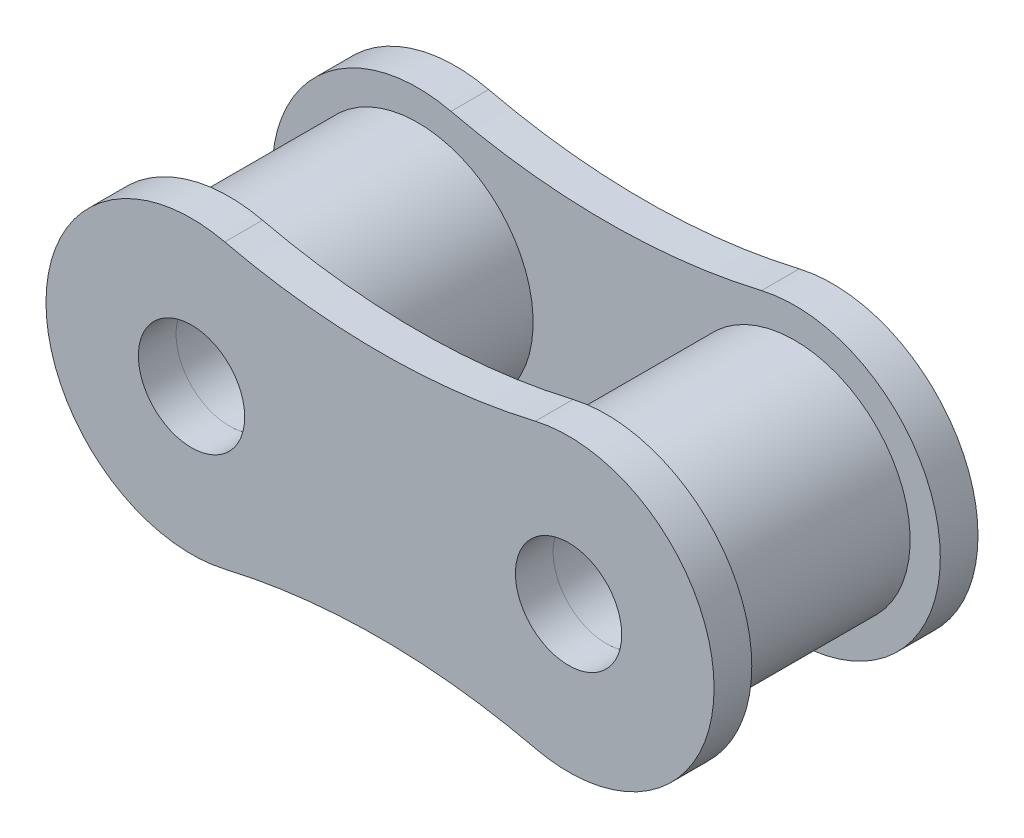
from build123d import *

# Parameters (mm, degrees)
SKETCH4_R             = 3.8862
SKETCH4_R_2           = 1.8161
BOSS_EXTRUDE1_DEPTH   = 3.175
BOSS_EXTRUDE1_2_DEPTH = 3.175
SKETCH5_R             = 1.7907
BOSS_EXTRUDE2_DEPTH   = 1.27


with BuildPart() as part:
    # Sketch4 → Boss-Extrude1 (new, symmetric)
    with BuildSketch(Plane.XY):
        with Locations((-6.35, 0)):
            Circle(SKETCH4_R)
        with Locations((-6.35, 0)):
            Circle(SKETCH4_R_2, mode=Mode.SUBTRACT)
    extrude(amount=BOSS_EXTRUDE1_DEPTH, both=True)


with BuildPart() as body_2:
    # Sketch4 → Boss-Extrude1 2 (new, symmetric)
    with BuildSketch(Plane.XY):
        with Locations((6.35, 0)):
            Circle(SKETCH4_R)
        with Locations((6.35, 0)):
            Circle(SKETCH4_R_2, mode=Mode.SUBTRACT)
    extrude(amount=BOSS_EXTRUDE1_2_DEPTH, both=True)


with BuildPart() as body_3:
    # Sketch5 → Boss-Extrude2 (new body)
    with BuildSketch(Plane.XY.offset(3.175)):
        with BuildLine():
            ThreePointArc((-5.229673653, 4.772466209), (-11.2522, 0), (-5.229673653, -4.772466209))
            ThreePointArc((-5.229673653, -4.772466209), (0, -4.16687), (5.229673653, -4.772466209))
            ThreePointArc((5.229673653, -4.772466209), (11.2522, 0), (5.229673653, 4.772466209))
            ThreePointArc((5.229673653, 4.772466209), (0, 4.16687), (-5.229673653, 4.772466209))
        make_face()
        with Locations((-6.35, 0)):
            Circle(SKETCH5_R, mode=Mode.SUBTRACT)
        with Locations((6.35, 0)):
            Circle(SKETCH5_R, mode=Mode.SUBTRACT)
    extrude(amount=BOSS_EXTRUDE2_DEPTH)


with BuildPart() as body_4:
    # Mirror3: mirrored copy
    add(body_3.part.mirror(Plane.XY))

    # Combine2: union body 3, body 2, part
    add(body_3.part)
    add(body_2.part)
    add(part.part)


solid = body_4.part
